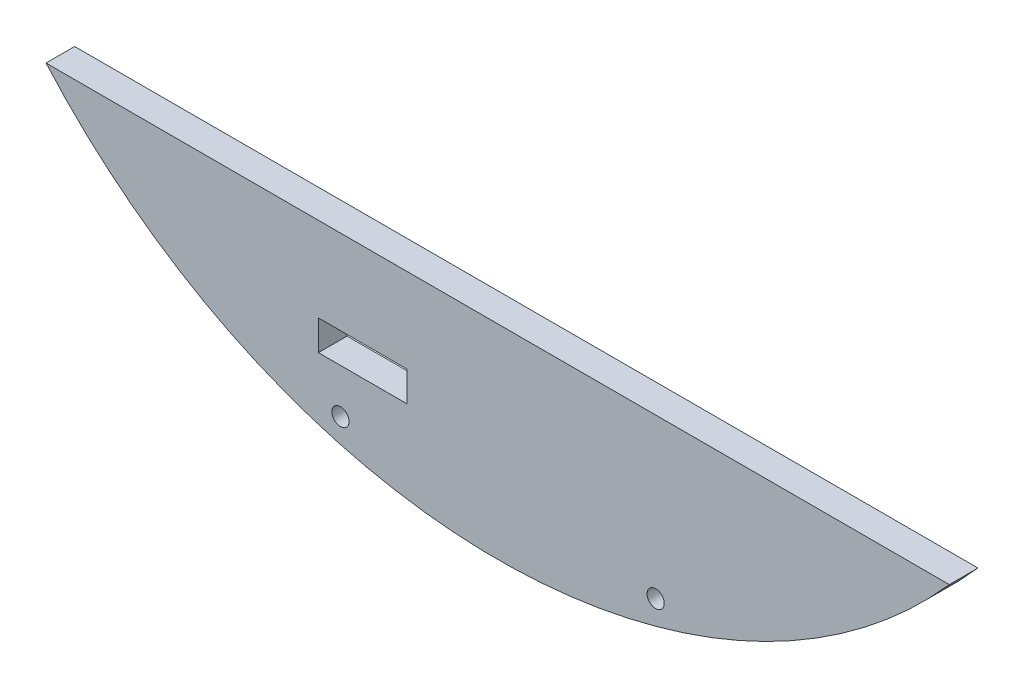
from build123d import *

# Parameters (mm, degrees)
ESQUISSE1_W             = 15.5
ESQUISSE1_H             = 5.25
BOSS_EXTRU_1_DEPTH      = 5
ESQUISSE2_R             = 1.5
ENL_V_MAT_EXTRU_1_DEPTH = 5


with BuildPart() as part:
    # Esquisse1 → Boss.-Extru.1 (new body)
    with BuildSketch(Plane.XY):
        with BuildLine():
            Line((78.965631611, -69.557615642), (-78.655820549, -69.557615642))
            ThreePointArc((-78.655820549, -69.557615642), (0.154905531, -105.175561372), (78.965631611, -69.557615642))
        make_face()
        with Locations((-23.37664966, -86.932615642)):
            Rectangle(ESQUISSE1_W, ESQUISSE1_H, mode=Mode.SUBTRACT)
    extrude(amount=BOSS_EXTRU_1_DEPTH)

    # Esquisse2 → Enlèv. mat.-Extru.1 (cut)
    with BuildSketch(Plane.XY.offset(5)):
        with Locations((-27.279170889, -97.307615642)):
            Circle(ESQUISSE2_R)
        with Locations((27.720829111, -97.307615642)):
            Circle(ESQUISSE2_R)
    extrude(amount=-ENL_V_MAT_EXTRU_1_DEPTH, mode=Mode.SUBTRACT)


solid = part.part
